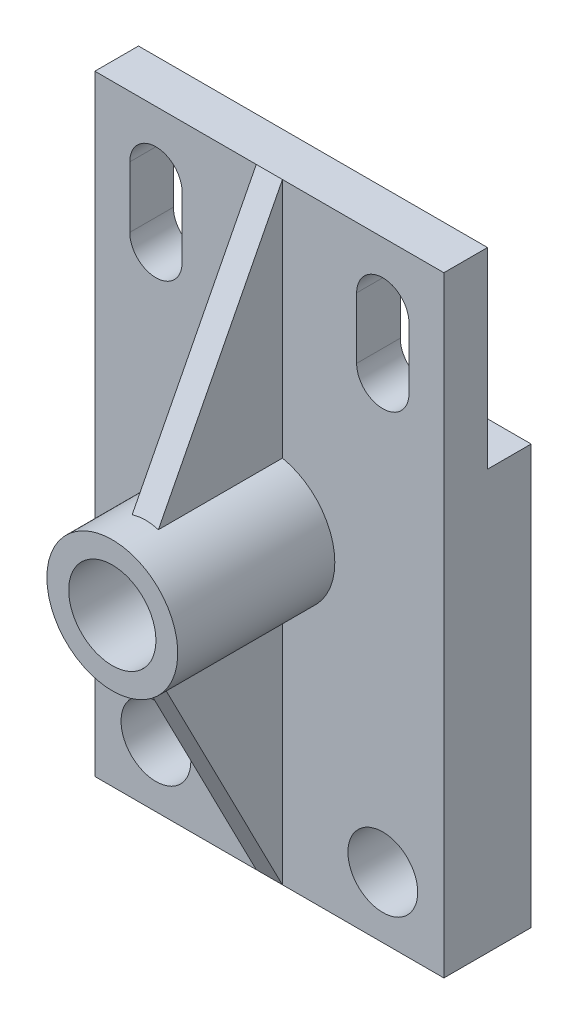
from build123d import *

# Parameters (mm, degrees)
SKETCH_1_W           = 40
SKETCH_1_H           = 70
SKETCH_1_R           = 4
EXTRUDE_1_DEPTH      = 10
SKETCH_2_W           = 5
SKETCH_2_H           = 22
CUT_EXTRUDE_1_DEPTH  = 55.083269132
SKETCH_3_R           = 7.5
EXTRUDE_2_DEPTH      = 18
SKETCH_4_R           = 10
EXTRUDE_3_DEPTH      = 2
EXTRUDE_4_DEPTH      = 1.5
EXTRUDE_4_DEPTH_BACK = 1.5
SKETCH_6_R           = 5
CUT_EXTRUDE_2_DEPTH  = 50.081564767
SKETCH_7_R           = 10
SKETCH_7_R_2         = 7.5
CUT_EXTRUDE_3_DEPTH  = 48.968739821


with BuildPart() as part:
    # Эскиз1 → Бобышка-Вытянуть1 (new body)
    with BuildSketch(Plane.XY):
        Rectangle(SKETCH_1_W, SKETCH_1_H)
        with Locations((13, -28)):
            Circle(SKETCH_1_R, mode=Mode.SUBTRACT)
        with Locations((-13, -28)):
            Circle(SKETCH_1_R, mode=Mode.SUBTRACT)
        with BuildLine():
            Line((10, 21), (10, 28))
            ThreePointArc((10, 28), (13, 31), (16, 28))
            Line((16, 28), (16, 21))
            ThreePointArc((16, 21), (13, 18), (10, 21))
        make_face(mode=Mode.SUBTRACT)
        with BuildLine():
            Line((-16, 21), (-16, 28))
            ThreePointArc((-16, 28), (-13, 31), (-10, 28))
            Line((-10, 28), (-10, 21))
            ThreePointArc((-10, 21), (-13, 18), (-16, 21))
        make_face(mode=Mode.SUBTRACT)
    extrude(amount=EXTRUDE_1_DEPTH)

    # Эскиз2 → Вырез-Вытянуть1 (cut, through all)
    with BuildSketch(Plane(origin=(20, 0, 0), x_dir=(0, 0, -1), z_dir=(1, 0, 0))):
        with Locations((-2.5, 24)):
            Rectangle(SKETCH_2_W, SKETCH_2_H)
    extrude(amount=-CUT_EXTRUDE_1_DEPTH, mode=Mode.SUBTRACT)

    # Эскиз3 → Бобышка-Вытянуть2 (add)
    with BuildSketch(Plane.XY.offset(10)):
        with Locations(Location((0, 0, 0), (0, 0, 180))):
            Circle(SKETCH_3_R)
    extrude(amount=EXTRUDE_2_DEPTH)

    # Эскиз4 → Бобышка-Вытянуть3 (add)
    with BuildSketch(Plane.XY.offset(28)):
        Circle(SKETCH_4_R)
    extrude(amount=-EXTRUDE_3_DEPTH)

    # Эскиз5 → Бобышка-Вытянуть4 (add, two sides: drawn at the far end of the back side and taken through both)
    with BuildSketch(Plane(origin=(0, 0, 0), x_dir=(0, 0, -1), z_dir=(1, 0, 0)).offset(-EXTRUDE_4_DEPTH_BACK)):
        Polygon((-10, 35), (-28, 0), (-10, -35), align=None)
    extrude(amount=EXTRUDE_4_DEPTH + EXTRUDE_4_DEPTH_BACK)

    # Эскиз6 → Вырез-Вытянуть2 (cut, through all)
    with BuildSketch(Plane.XY.offset(28)):
        Circle(SKETCH_6_R)
    extrude(amount=-CUT_EXTRUDE_2_DEPTH, mode=Mode.SUBTRACT)

    # Эскиз7 → Вырез-Вытянуть3 (cut, through all)
    with BuildSketch(Plane(origin=(0, 0, 26), x_dir=(-1, 0, 0), z_dir=(0, 0, -1))):
        Circle(SKETCH_7_R)
        Circle(SKETCH_7_R_2, mode=Mode.SUBTRACT)
    extrude(amount=-CUT_EXTRUDE_3_DEPTH, mode=Mode.SUBTRACT)


solid = part.part
